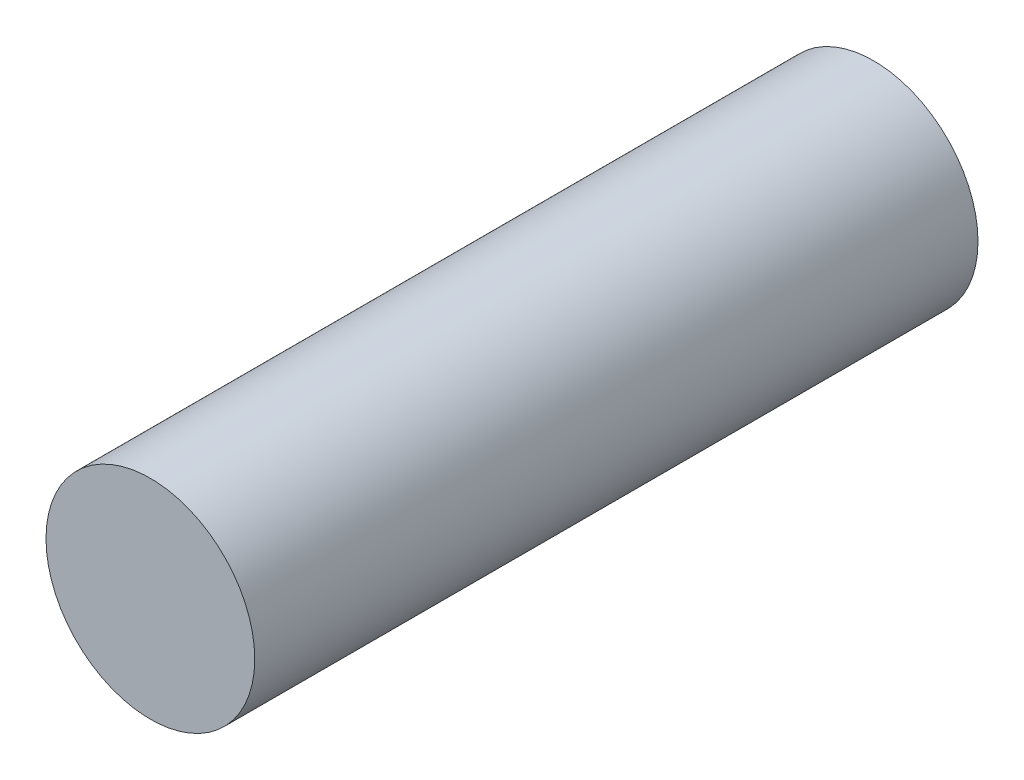
from build123d import *

# Parameters (mm, degrees)
SKETCH1_R           = 6.35
BOSS_EXTRUDE1_DEPTH = 44


with BuildPart() as part:
    # Sketch1 → Boss-Extrude1 (new body)
    with BuildSketch(Plane.XY):
        Circle(SKETCH1_R)
    extrude(amount=BOSS_EXTRUDE1_DEPTH)


solid = part.part
